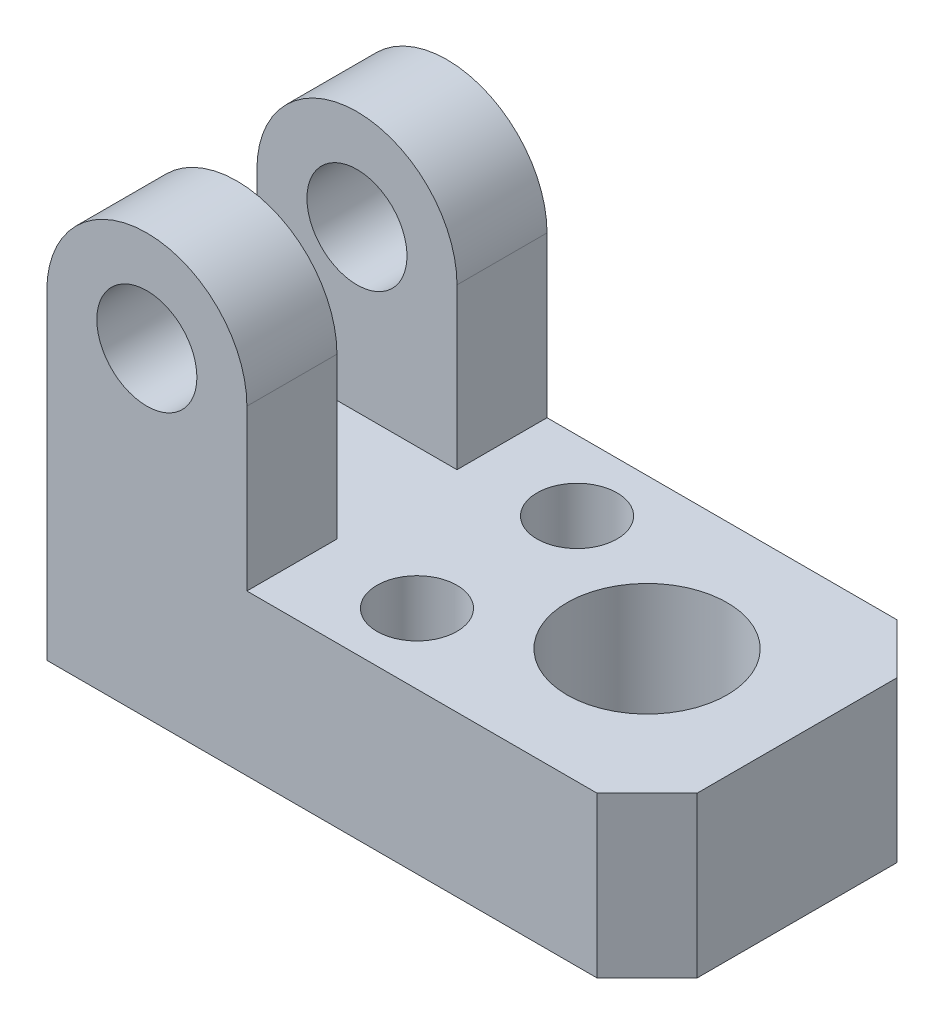
from build123d import *

# Parameters (mm, degrees)
SKETCH2_W           = 60
SKETCH2_H           = 30
BOSS_EXTRUDE1_DEPTH = 16
BOSS_EXTRUDE2_DEPTH = 9
SKETCH4_R           = 5
CUT_EXTRUDE1_DEPTH  = 60.699246226
SKETCH5_R           = 8
SKETCH5_R_2         = 4
CUT_EXTRUDE2_DEPTH  = 43.438190348
CHAMFER1_SIZE       = 5


with BuildPart() as part:
    # Sketch2 → Boss-Extrude1 (new body)
    with BuildSketch(Plane(origin=(0, 0, 0), x_dir=(1, 0, 0), z_dir=(0, 1, 0))):
        Rectangle(SKETCH2_W, SKETCH2_H)
    extrude(amount=BOSS_EXTRUDE1_DEPTH)

    # Sketch3 → Boss-Extrude2 (add)
    with BuildSketch(Plane(origin=(0, 0, -15), x_dir=(-1, 0, 0), z_dir=(0, 0, -1))):
        with BuildLine():
            Line((30, 16), (10, 16))
            Line((10, 16), (10, 32))
            ThreePointArc((10, 32), (20, 42), (30, 32))
            Line((30, 32), (30, 16))
        make_face()
    boss_extrude2 = extrude(amount=-BOSS_EXTRUDE2_DEPTH)

    # Sketch4 → Cut-Extrude1 (cut, through all)
    with BuildSketch(Plane(origin=(0, 0, -15), x_dir=(-1, 0, 0), z_dir=(0, 0, -1))):
        with Locations((20, 32)):
            Circle(SKETCH4_R)
    cut_extrude1 = extrude(amount=-CUT_EXTRUDE1_DEPTH, mode=Mode.SUBTRACT)

    # Mirror1: Boss-Extrude2, Cut-Extrude1 across plane
    add(boss_extrude2.mirror(Plane.XY))
    add(cut_extrude1.mirror(Plane.XY), mode=Mode.SUBTRACT)

    # Sketch5 → Cut-Extrude2 (cut, through all)
    with BuildSketch(Plane(origin=(0, 16, 0), x_dir=(1, 0, 0), z_dir=(0, 1, 0))):
        with Locations(Location((15, 0, 0), (0, 0, 270))):
            Circle(SKETCH5_R)
        with Locations(Location((0, -8, 0), (0, 0, 270))):
            Circle(SKETCH5_R_2)
        with Locations(Location((0, 8, 0), (0, 0, 90))):
            Circle(SKETCH5_R_2)
    extrude(amount=-CUT_EXTRUDE2_DEPTH, mode=Mode.SUBTRACT)

    # Chamfer1
    chamfer1_edges = [part.edges().sort_by_distance(p)[0] for p in [
        (30, 8, 15),
        (30, 8, -15),
    ]]
    chamfer(chamfer1_edges, length=CHAMFER1_SIZE)


solid = part.part
